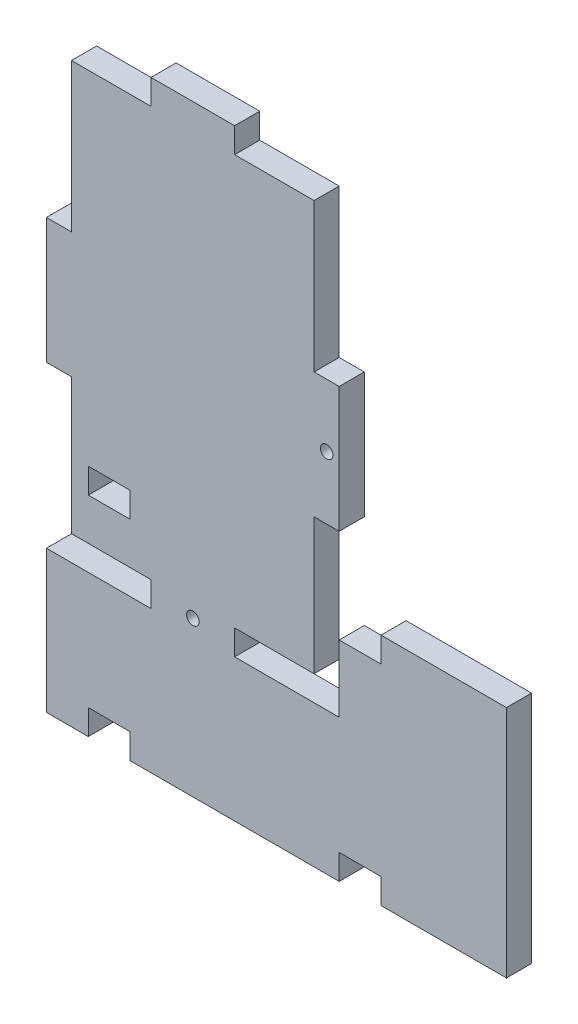
from build123d import *

# Parameters (mm, degrees)
ESQUISSE1_W             = 110
ESQUISSE1_H             = 144
BOSS_EXTRU_1_DEPTH      = 6
ESQUISSE2_W             = 10
ESQUISSE2_H             = 6
ENL_V_MAT_EXTRU_1_DEPTH = 182.306370544
ESQUISSE3_R             = 1.5
ENL_V_MAT_EXTRU_2_DEPTH = 182.306370544
ESQUISSE4_R             = 2.995
ESQUISSE4_R_2           = 3
ENL_V_MAT_EXTRU_3_DEPTH = 3


with BuildPart() as part:
    # Esquisse1 → Boss.-Extru.1 (new body)
    with BuildSketch(Plane.XY):
        with Locations((-55, 72)):
            Rectangle(ESQUISSE1_W, ESQUISSE1_H)
    extrude(amount=BOSS_EXTRU_1_DEPTH)

    # Esquisse2 → Enlèv. mat.-Extru.1 (cut, through all)
    with BuildSketch(Plane(origin=(0, 0, 0), x_dir=(-1, 0, 0), z_dir=(0, 0, -1))):
        Polygon((40, 102.5), (40, 72.5), (46, 72.5), (46, 40), (65, 40), (65, 34), (40, 34), (40, 50), (30, 50), (30, 56), (0, 56), (0, 144), (65, 144), (65, 138), (46, 138), (46, 102.5), align=None)
        Polygon((110, 144), (85, 144), (85, 138), (104, 138), (104, 102.5), (110, 102.5), align=None)
        Polygon((110, 72.5), (110, 34), (85, 34), (85, 40), (104, 40), (104, 72.5), align=None)
        with Locations((95, 3)):
            Rectangle(ESQUISSE2_W, ESQUISSE2_H)
        with Locations((35, 3)):
            Rectangle(ESQUISSE2_W, ESQUISSE2_H)
        with Locations((95, 53)):
            Rectangle(ESQUISSE2_W, ESQUISSE2_H)
    extrude(amount=-ENL_V_MAT_EXTRU_1_DEPTH, mode=Mode.SUBTRACT)

    # Esquisse3 → Enlèv. mat.-Extru.2 (cut, through all)
    with BuildSketch(Plane(origin=(0, 0, 0), x_dir=(-1, 0, 0), z_dir=(0, 0, -1))):
        with Locations((43, 87.5)):
            Circle(ESQUISSE3_R)
        with Locations((75, 37)):
            Circle(ESQUISSE3_R)
    extrude(amount=-ENL_V_MAT_EXTRU_2_DEPTH, mode=Mode.SUBTRACT)

    # Esquisse4 → Enlèv. mat.-Extru.3 (cut)
    with BuildSketch(Plane(origin=(0, 0, 0), x_dir=(-1, 0, 0), z_dir=(0, 0, -1))):
        with Locations((43, 87.5)):
            Circle(ESQUISSE4_R)
        with Locations((75, 37)):
            Circle(ESQUISSE4_R_2)
    extrude(amount=-ENL_V_MAT_EXTRU_3_DEPTH, mode=Mode.SUBTRACT)


solid = part.part
